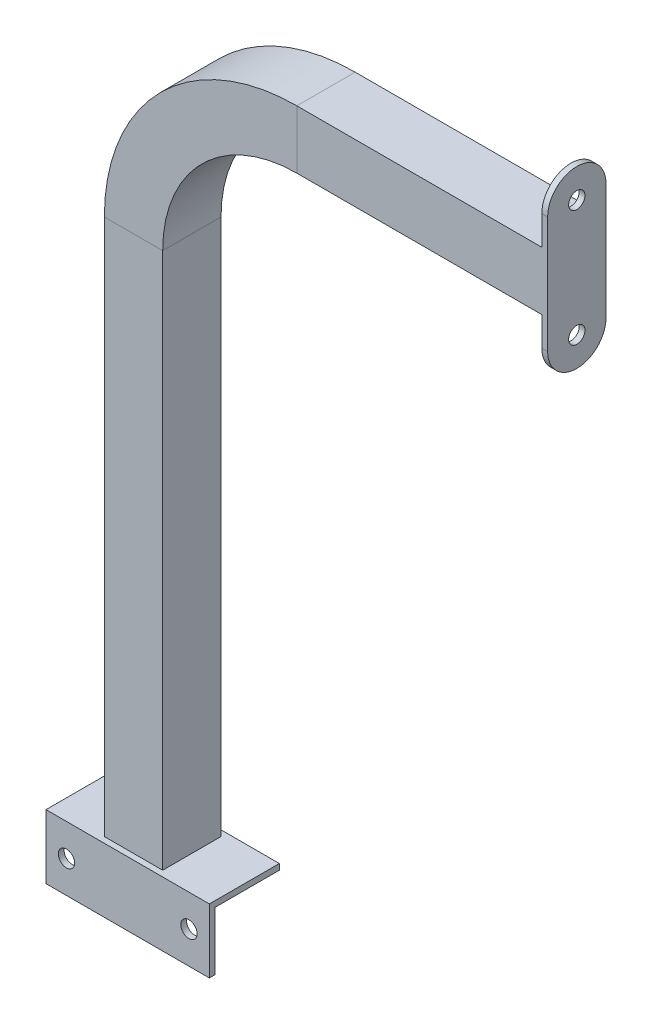
from build123d import *

# Parameters (mm, degrees)
SKETCH2_W           = 140
SKETCH2_H           = 60
BOSS_EXTRUDE2_DEPTH = 5
SKETCH3_W           = 140
SKETCH3_H           = 5
BOSS_EXTRUDE3_DEPTH = 50
SKETCH4_R           = 7
CUT_EXTRUDE1_DEPTH  = 108.354552768
SKETCH6_W           = 50
SKETCH6_H           = 50
SKETCH6_W_2         = 40
SKETCH6_H_2         = 40
SKETCH7_R           = 7
BOSS_EXTRUDE4_DEPTH = 5
SKETCH8_W           = 140
SKETCH8_H           = 50
CUT_EXTRUDE2_DEPTH  = 5


with BuildPart() as part:
    # Sketch2 → Boss-Extrude2 (new body)
    with BuildSketch(Plane(origin=(0, 0, 0), x_dir=(1, 0, 0), z_dir=(0, 1, 0))):
        Rectangle(SKETCH2_W, SKETCH2_H)
    extrude(amount=-BOSS_EXTRUDE2_DEPTH)

    # Sketch3 → Boss-Extrude3 (add)
    with BuildSketch(Plane.XZ.offset(5)):
        with Locations((0, -27.5)):
            Rectangle(SKETCH3_W, SKETCH3_H)
        with Locations((0, 27.5)):
            Rectangle(SKETCH3_W, SKETCH3_H)
    extrude(amount=BOSS_EXTRUDE3_DEPTH)

    # Sketch4 → Cut-Extrude1 (cut, through all)
    with BuildSketch(Plane(origin=(0, 0, -30), x_dir=(-1, 0, 0), z_dir=(0, 0, -1))):
        with Locations((-52.5, -27.5)):
            Circle(SKETCH4_R)
        with Locations((52.5, -27.5)):
            Circle(SKETCH4_R)
    extrude(amount=-CUT_EXTRUDE1_DEPTH, mode=Mode.SUBTRACT)

    # Sweep1: sweep along a path in Sketch5
    with BuildLine(Plane.XY) as sweep1_path:
        Line((0, 0), (0, 460))
        ThreePointArc((0, 460), (41.005050634, 558.994949366), (140, 600))
        Line((140, 600), (350, 600))
    # Sketch6 → Sweep1 (sweep)
    with BuildSketch(Plane(origin=(0, 0, 0), x_dir=(1, 0, 0), z_dir=(0, 1, 0))):
        Rectangle(SKETCH6_W, SKETCH6_H)
        Rectangle(SKETCH6_W_2, SKETCH6_H_2, mode=Mode.SUBTRACT)
    sweep(path=sweep1_path.line)

    # Sketch7 → Boss-Extrude4 (add)
    with BuildSketch(Plane(origin=(350, 0, 0), x_dir=(0, 0, -1), z_dir=(1, 0, 0))):
        with BuildLine():
            Line((-25, 550), (-25, 650))
            ThreePointArc((-25, 650), (0, 675), (25, 650))
            Line((25, 650), (25, 550))
            ThreePointArc((25, 550), (0, 525), (-25, 550))
        make_face()
        with Locations(Location((0, 650, 0), (0, 0, 90))):
            Circle(SKETCH7_R, mode=Mode.SUBTRACT)
        with Locations(Location((0, 550, 0), (0, 0, 270))):
            Circle(SKETCH7_R, mode=Mode.SUBTRACT)
    extrude(amount=BOSS_EXTRUDE4_DEPTH)

    # Sketch8 → Cut-Extrude2 (cut)
    with BuildSketch(Plane(origin=(0, 0, -30), x_dir=(-1, 0, 0), z_dir=(0, 0, -1))):
        with Locations((0, -30)):
            Rectangle(SKETCH8_W, SKETCH8_H)
    extrude(amount=-CUT_EXTRUDE2_DEPTH, mode=Mode.SUBTRACT)


solid = part.part
